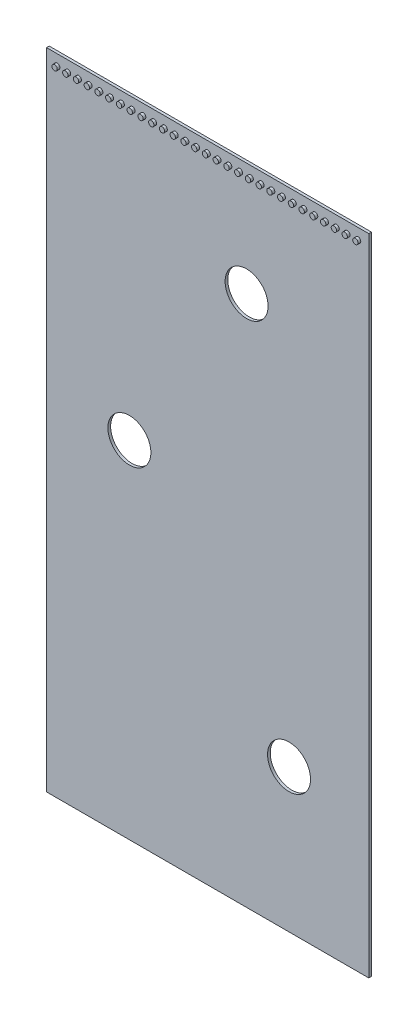
from build123d import *

# Parameters (mm, degrees)
SKETCH1_W           = 762
SKETCH1_H           = 1524
SKETCH1_R           = 50.8
BOSS_EXTRUDE1_DEPTH = 6.35
SKETCH3_R           = 6.35
BOSS_EXTRUDE2_DEPTH = 9.525
LPATTERN1_COUNT     = 29
LPATTERN1_PITCH     = 25.4


with BuildPart() as part:
    # Sketch1 → Boss-Extrude1 (new body)
    with BuildSketch(Plane.XY):
        with Locations((381, 762)):
            Rectangle(SKETCH1_W, SKETCH1_H)
        with Locations((473.040992839, 1256.517236174)):
            Circle(SKETCH1_R, mode=Mode.SUBTRACT)
        with Locations((195.985521076, 818.027867477)):
            Circle(SKETCH1_R, mode=Mode.SUBTRACT)
        with Locations((573.391793635, 338.089254973)):
            Circle(SKETCH1_R, mode=Mode.SUBTRACT)
    extrude(amount=BOSS_EXTRUDE1_DEPTH)

    # Sketch3 → Boss-Extrude2 (add, symmetric)
    with BuildSketch(Plane.XY.offset(3.175)):
        with Locations(Location((25.4, 1498.6, 0), (0, 0, 180))):
            Circle(SKETCH3_R)
    boss_extrude2 = extrude(amount=BOSS_EXTRUDE2_DEPTH, both=True)

    # LPattern1: Boss-Extrude2 ×29
    with Locations(*[(i * LPATTERN1_PITCH, 0, 0) for i in range(1, LPATTERN1_COUNT)]):
        add(boss_extrude2)


solid = part.part
